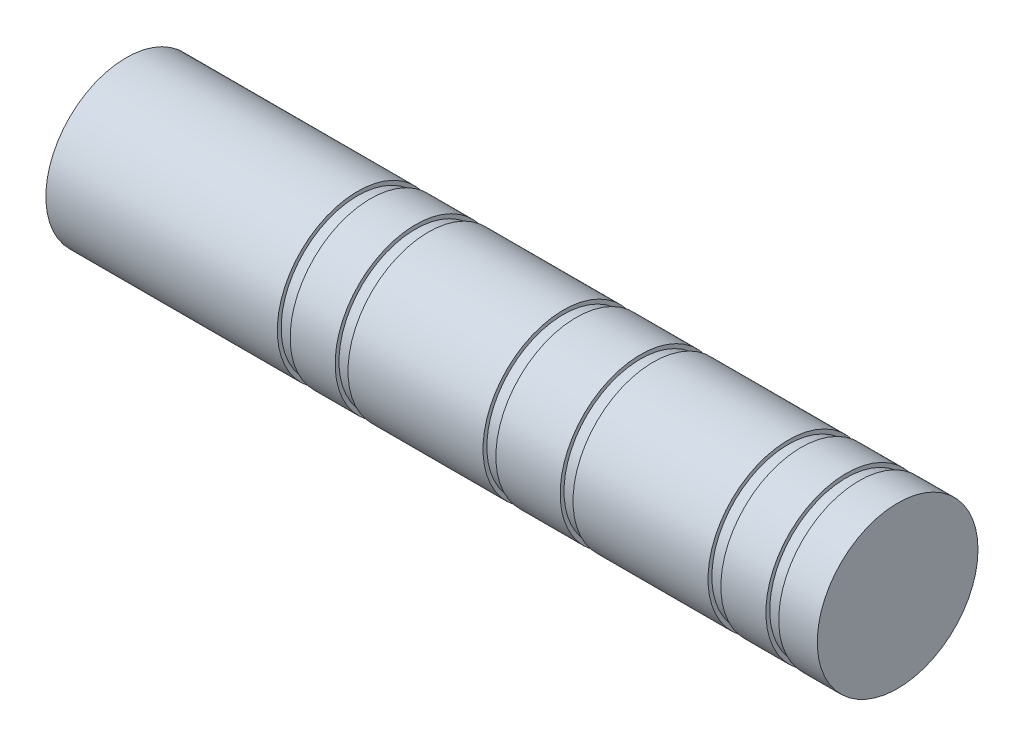
from build123d import *

# Parameters (mm, degrees)
SKETCH1_R                 = 2.5
BOSS_EXTRUDE1_DEPTH       = 12
F_3_CLEARANCE_HOLE1_D     = 2.794
F_3_CLEARANCE_HOLE1_DEPTH = 5
F_3_CLEARANCE_HOLE1_TIP   = 0.839402285
SKETCH4_W                 = 0.4
SKETCH4_H                 = 0.12


with BuildPart() as part:
    # Sketch1 → Boss-Extrude1 (new, symmetric)
    with BuildSketch(Plane(origin=(0, 0, 0), x_dir=(0, 0, -1), z_dir=(1, 0, 0))):
        Circle(SKETCH1_R)
    extrude(amount=BOSS_EXTRUDE1_DEPTH, both=True)

    # #3 Clearance Hole1
    with Locations(Plane.ZY.offset(12)):
        with Locations((0, 0)):
            Hole(F_3_CLEARANCE_HOLE1_D / 2, depth=F_3_CLEARANCE_HOLE1_DEPTH)
            with Locations((0, 0, -(F_3_CLEARANCE_HOLE1_DEPTH + F_3_CLEARANCE_HOLE1_TIP / 2))):  # 118° drill point
                Cone(0, F_3_CLEARANCE_HOLE1_D / 2, F_3_CLEARANCE_HOLE1_TIP, mode=Mode.SUBTRACT)

    # Sketch4 → Cut-Revolve1 (revolve, cut)
    with BuildSketch(Plane(origin=(0, 0, 0), x_dir=(1, 0, 0), z_dir=(0, 1, 0))):
        with Locations((10.6, 2.44)):
            Rectangle(SKETCH4_W, SKETCH4_H)
        with Locations((8.8, 2.44)):
            Rectangle(SKETCH4_W, SKETCH4_H)
        with Locations((-2.8, 2.44)):
            Rectangle(SKETCH4_W, SKETCH4_H)
        with Locations((-4.6, 2.44)):
            Rectangle(SKETCH4_W, SKETCH4_H)
        with Locations((1.8, 2.44)):
            Rectangle(SKETCH4_W, SKETCH4_H)
        with Locations((4.2, 2.44)):
            Rectangle(SKETCH4_W, SKETCH4_H)
    revolve(axis=Axis((13.2, 0, 0), (-1, 0, 0)), mode=Mode.SUBTRACT)


solid = part.part
